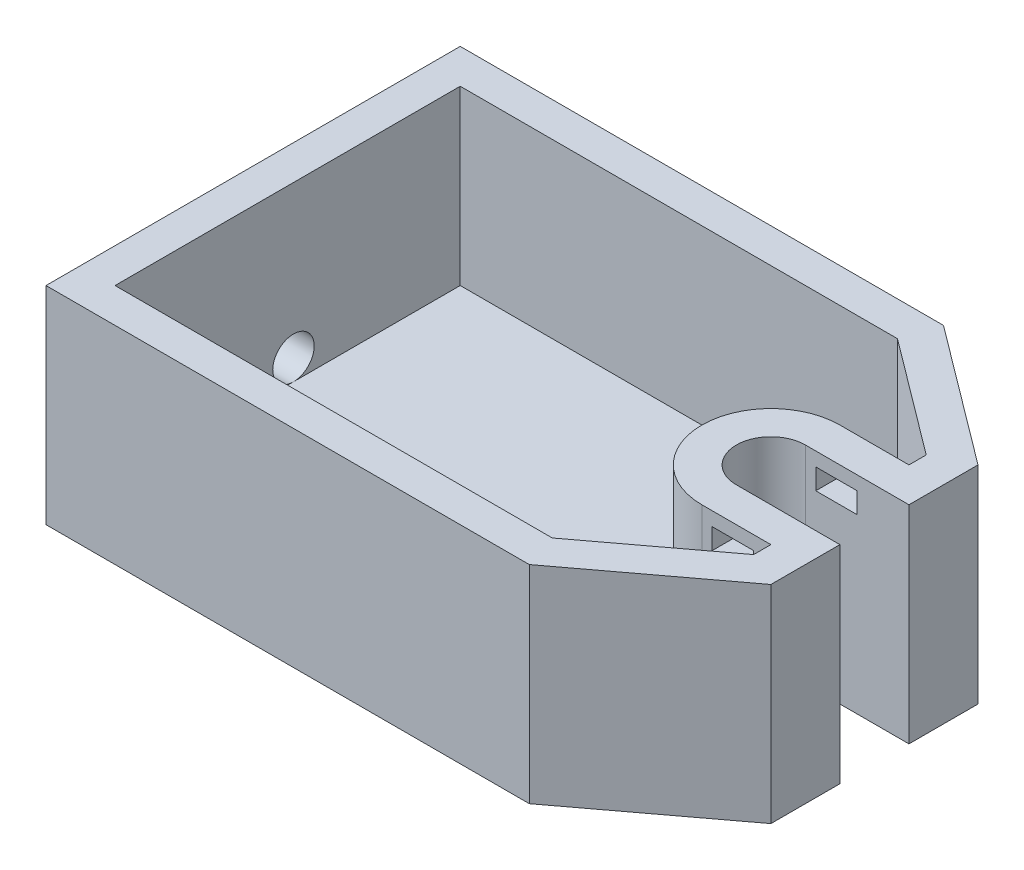
from build123d import *

# Parameters (mm, degrees)
BOSS_EXTRUDE3_DEPTH = 76.2
CUT_EXTRUDE1_DEPTH  = 63.5
SKETCH6_R           = 7.62
SKETCH6_W           = 10.16
SKETCH6_H           = 10.16
CUT_EXTRUDE2_DEPTH  = 12.7
CUT_EXTRUDE3_REACH  = 263.509
SKETCH12_W          = 15.24
SKETCH12_H          = 7.62


with BuildPart() as part:
    # Sketch1 → Boss-Extrude3 (new body)
    with BuildSketch(Plane(origin=(0, 0, 0), x_dir=(1, 0, 0), z_dir=(0, 1, 0))):
        Polygon((177.8, 76.2), (0, 76.2), (0, 0), (177.8, 0), (177.8, 38.1), (177.8, 63.5), align=None)
        Polygon((0, 152.4), (0, 76.2), (177.8, 76.2), (177.8, 88.9), (177.8, 114.3), (177.8, 152.4), align=None)
        Polygon((228.6, 114.3), (177.8, 152.4), (177.8, 114.3), align=None)
        Polygon((177.8, 114.3), (177.8, 88.9), (190.5, 88.9), (228.6, 88.9), (228.6, 114.3), align=None)
        Polygon((177.8, 38.1), (177.8, 0), (228.6, 38.1), align=None)
        Polygon((190.5, 63.5), (177.8, 63.5), (177.8, 38.1), (228.6, 38.1), (228.6, 63.5), align=None)
        with BuildLine():
            ThreePointArc((190.5, 63.5), (181.519743879, 67.219743879), (177.8, 76.2))
            Line((177.8, 76.2), (177.8, 63.5))
            Line((177.8, 63.5), (190.5, 63.5))
        make_face()
        with BuildLine():
            Line((177.8, 88.9), (177.8, 76.2))
            ThreePointArc((177.8, 76.2), (181.519743879, 85.180256121), (190.5, 88.9))
            Line((190.5, 88.9), (177.8, 88.9))
        make_face()
    extrude(amount=BOSS_EXTRUDE3_DEPTH)

    # Sketch4 → Cut-Extrude1 (cut)
    with BuildSketch(Plane(origin=(0, 76.2, 0), x_dir=(1, 0, 0), z_dir=(0, 1, 0))):
        with BuildLine():
            Line((215.9, 101.6), (215.9, 107.95))
            Line((215.9, 107.95), (173.566666667, 139.7))
            Line((173.566666667, 139.7), (12.7, 139.7))
            Line((12.7, 139.7), (12.7, 12.7))
            Line((12.7, 12.7), (173.566666667, 12.7))
            Line((173.566666667, 12.7), (215.9, 44.45))
            Line((215.9, 44.45), (215.9, 50.8))
            Line((215.9, 50.8), (190.5, 50.8))
            ThreePointArc((190.5, 50.8), (165.1, 76.2), (190.5, 101.6))
            Line((190.5, 101.6), (215.9, 101.6))
        make_face()
    extrude(amount=-CUT_EXTRUDE1_DEPTH, mode=Mode.SUBTRACT)

    # Sketch6 → Cut-Extrude2 (cut)
    with BuildSketch(Plane.ZY):
        with Locations((-78.343351815, 20.32)):
            Circle(SKETCH6_R)
        with Locations((-30.565080817, 20.32)):
            Rectangle(SKETCH6_W, SKETCH6_H)
    extrude(amount=-CUT_EXTRUDE2_DEPTH, mode=Mode.SUBTRACT)

    # Cut-Extrude3: up to this face of the body (flat: up to its plane)
    cut_extrude3_end = Plane(part.part.faces().sort_by_distance((203.2, 44.45, -101.6))[0])
    # Sketch12 → Cut-Extrude3 (cut, up to the picked face)
    with BuildSketch(Plane.XY.offset(-50.8), mode=Mode.PRIVATE) as cut_extrude3_sk1:
        with Locations((201.93, 67.31)):
            Rectangle(SKETCH12_W, SKETCH12_H)
    cut_extrude3_tool1 = split(extrude(cut_extrude3_sk1.sketch, amount=-CUT_EXTRUDE3_REACH, mode=Mode.PRIVATE), bisect_by=cut_extrude3_end, keep=Keep.BOTH, mode=Mode.PRIVATE)
    add(cut_extrude3_tool1.solids().sort_by(Axis((201.93, 67.31, -50.8), (0, 0, -1)))[0], mode=Mode.SUBTRACT)


solid = part.part
